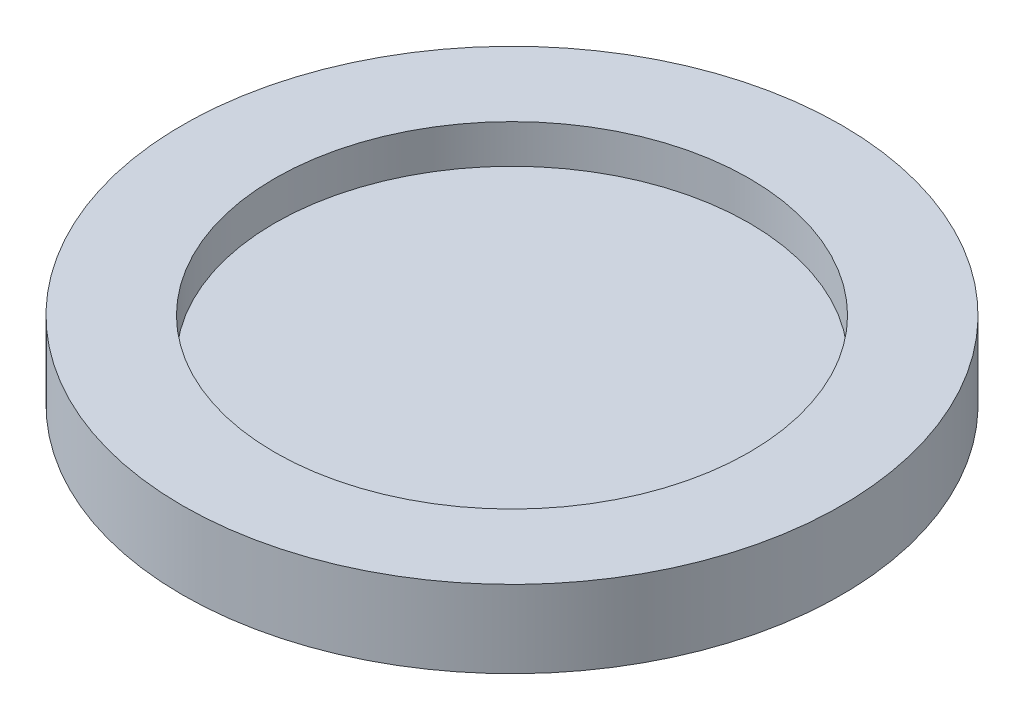
from build123d import *

# Parameters (mm, degrees)
SKETCH1_R           = 9.375
BOSS_EXTRUDE1_DEPTH = 2.2
SKETCH2_R           = 6.75
CUT_EXTRUDE1_DEPTH  = 1.1


with BuildPart() as part:
    # Sketch1 → Boss-Extrude1 (new body)
    with BuildSketch(Plane(origin=(0, 0, 0), x_dir=(1, 0, 0), z_dir=(0, 1, 0))):
        with Locations(Location((0, 0, 0), (0, 0, 270))):
            Circle(SKETCH1_R)
    extrude(amount=BOSS_EXTRUDE1_DEPTH)

    # Sketch2 → Cut-Extrude1 (cut)
    with BuildSketch(Plane(origin=(0, 2.2, 0), x_dir=(1, 0, 0), z_dir=(0, 1, 0))):
        with Locations(Location((0, 0, 0), (0, 0, 270))):
            Circle(SKETCH2_R)
    extrude(amount=-CUT_EXTRUDE1_DEPTH, mode=Mode.SUBTRACT)


solid = part.part
